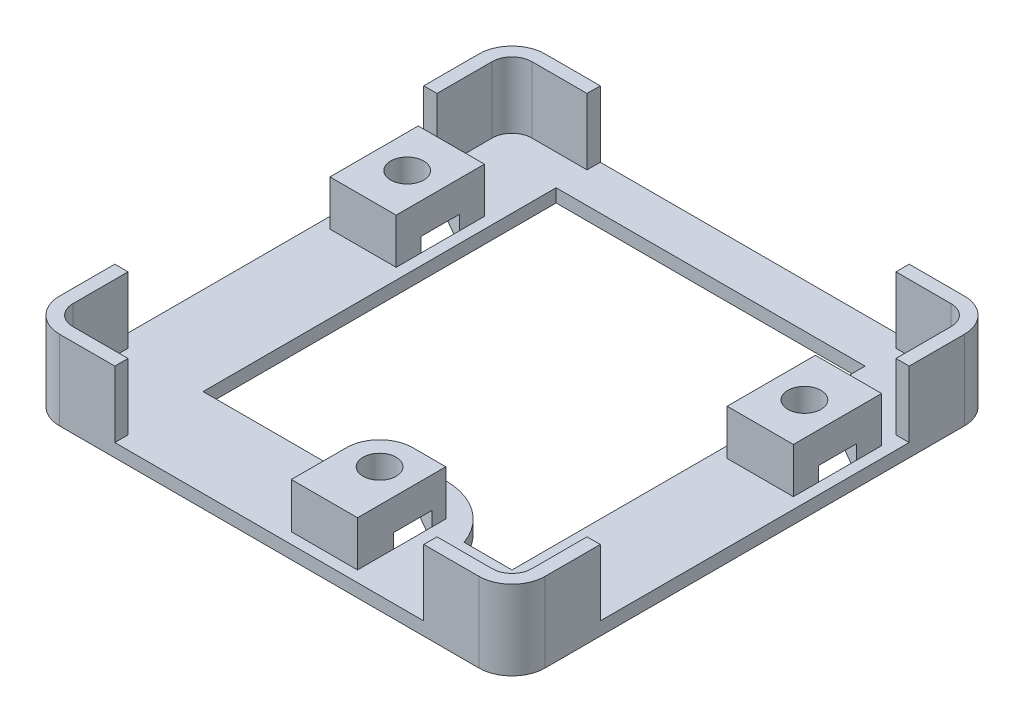
from build123d import *

# Parameters (mm, degrees)
SKETCH1_R           = 1.5
BOSS_EXTRUDE1_DEPTH = 1.2
BOSS_EXTRUDE4_DEPTH = 6
SKETCH5_W           = 6
SKETCH5_H           = 8
BOSS_EXTRUDE8_DEPTH = 4.1
SKETCH1_3_R         = 1.5
CUT_EXTRUDE1_DEPTH  = 2.5
SKETCH1_4_R         = 1.5
CUT_EXTRUDE2_DEPTH  = 63.640561939


with BuildPart() as part:
    # Sketch1 → Boss-Extrude1 (new body)
    with BuildSketch(Plane(origin=(0, 0, 0), x_dir=(1, 0, 0), z_dir=(0, 1, 0))):
        with BuildLine():
            ThreePointArc((0, 3), (0.878679656, 0.878679656), (3, 0))
            Line((3, 0), (41, 0))
            ThreePointArc((41, 0), (43.121320344, 0.878679656), (44, 3))
            Line((44, 3), (44, 41))
            ThreePointArc((44, 41), (43.121320344, 43.121320344), (41, 44))
            Line((41, 44), (3, 44))
            ThreePointArc((3, 44), (0.878679656, 43.121320344), (0, 41))
            Line((0, 41), (0, 3))
        make_face()
        with BuildLine():
            Line((36, 8), (31.656854249, 8))
            ThreePointArc((31.656854249, 8), (26, 12), (20.343145751, 8))
            Line((20.343145751, 8), (8, 8))
            Line((8, 8), (8, 40))
            Line((8, 40), (36, 40))
            Line((36, 40), (36, 8))
        make_face(mode=Mode.SUBTRACT)
        with Locations((26, 6)):
            Circle(SKETCH1_R, mode=Mode.SUBTRACT)
        with Locations((4, 30.5)):
            Circle(SKETCH1_R, mode=Mode.SUBTRACT)
        with Locations((40, 30.5)):
            Circle(SKETCH1_R, mode=Mode.SUBTRACT)
    extrude(amount=BOSS_EXTRUDE1_DEPTH)

    # Sketch4 → Boss-Extrude4 (add)
    with BuildSketch(Plane(origin=(0, 1.2, 0), x_dir=(1, 0, 0), z_dir=(0, 1, 0))):
        with BuildLine():
            Line((3, 44), (8, 44))
            Line((8, 44), (8, 42.8))
            Line((8, 42.8), (3, 42.8))
            ThreePointArc((3, 42.8), (1.727207794, 42.272792206), (1.2, 41))
            Line((1.2, 41), (1.2, 36))
            Line((1.2, 36), (0, 36))
            Line((0, 36), (0, 41))
            ThreePointArc((0, 41), (0.878679656, 43.121320344), (3, 44))
        make_face()
        with BuildLine():
            Line((41, 44), (36, 44))
            Line((36, 44), (36, 42.8))
            Line((36, 42.8), (41, 42.8))
            ThreePointArc((41, 42.8), (42.272792206, 42.272792206), (42.8, 41))
            Line((42.8, 41), (42.8, 36))
            Line((42.8, 36), (44, 36))
            Line((44, 36), (44, 41))
            ThreePointArc((44, 41), (43.121320344, 43.121320344), (41, 44))
        make_face()
        with BuildLine():
            Line((41, 0), (36, 0))
            Line((36, 0), (36, 1.2))
            Line((36, 1.2), (41, 1.2))
            ThreePointArc((41, 1.2), (42.272792206, 1.727207794), (42.8, 3))
            Line((42.8, 3), (42.8, 8))
            Line((42.8, 8), (44, 8))
            Line((44, 8), (44, 3))
            ThreePointArc((44, 3), (43.121320344, 0.878679656), (41, 0))
        make_face()
        with BuildLine():
            Line((3, 0), (8, 0))
            Line((8, 0), (8, 1.2))
            Line((8, 1.2), (3, 1.2))
            ThreePointArc((3, 1.2), (1.727207794, 1.727207794), (1.2, 3))
            Line((1.2, 3), (1.2, 8))
            Line((1.2, 8), (0, 8))
            Line((0, 8), (0, 3))
            ThreePointArc((0, 3), (0.878679656, 0.878679656), (3, 0))
        make_face()
    extrude(amount=BOSS_EXTRUDE4_DEPTH)

    # Sketch5 → Boss-Extrude8 (add)
    with BuildSketch(Plane(origin=(0, 1.2, 0), x_dir=(1, 0, 0), z_dir=(0, 1, 0))):
        with Locations((4, 30.5)):
            Rectangle(SKETCH5_W, SKETCH5_H)
        with Locations((40, 30.5)):
            Rectangle(SKETCH5_W, SKETCH5_H)
        with BuildLine():
            Line((26, 9), (29, 9))
            Line((29, 9), (29, 1))
            Line((29, 1), (23, 1))
            Line((23, 1), (23, 6))
            ThreePointArc((23, 6), (23.878679656, 8.121320344), (26, 9))
        make_face()
    extrude(amount=BOSS_EXTRUDE8_DEPTH)

    # Sketch1<3> → Cut-Extrude1 (cut)
    # profile 1 of 3: a face of its own
    with BuildSketch(Plane(origin=(0, 0, 0), x_dir=(1, 0, 0), z_dir=(0, 1, 0))):
        Polygon((4, 33.964101615), (1, 32.232050808), (1, 28.767949192), (4, 27.035898385), (7, 28.767949192), (7, 32.232050808), align=None)
        with Locations((4, 30.5)):
            Circle(SKETCH1_3_R, mode=Mode.SUBTRACT)
    # profile 2 of 3: a face of its own
    with BuildSketch(Plane(origin=(0, 0, 0), x_dir=(1, 0, 0), z_dir=(0, 1, 0))):
        Polygon((40, 33.964101615), (37, 32.232050808), (37, 28.767949192), (40, 27.035898385), (43, 28.767949192), (43, 32.232050808), align=None)
        with Locations((40, 30.5)):
            Circle(SKETCH1_3_R, mode=Mode.SUBTRACT)
    # profile 3 of 3: a face of its own
    with BuildSketch(Plane(origin=(0, 0, 0), x_dir=(1, 0, 0), z_dir=(0, 1, 0))):
        Polygon((26, 9.464101615), (23, 7.732050808), (23, 4.267949192), (26, 2.535898385), (29, 4.267949192), (29, 7.732050808), align=None)
        with Locations((26, 6)):
            Circle(SKETCH1_3_R, mode=Mode.SUBTRACT)
    extrude(amount=CUT_EXTRUDE1_DEPTH, mode=Mode.SUBTRACT)

    # Sketch1<4> → Cut-Extrude2 (cut, through all)
    with BuildSketch(Plane(origin=(0, 0, 0), x_dir=(1, 0, 0), z_dir=(0, 1, 0))):
        with Locations((4, 30.5)):
            Circle(SKETCH1_4_R)
        with Locations((40, 30.5)):
            Circle(SKETCH1_4_R)
        with Locations((26, 6)):
            Circle(SKETCH1_4_R)
    extrude(amount=CUT_EXTRUDE2_DEPTH, mode=Mode.SUBTRACT)


solid = part.part
